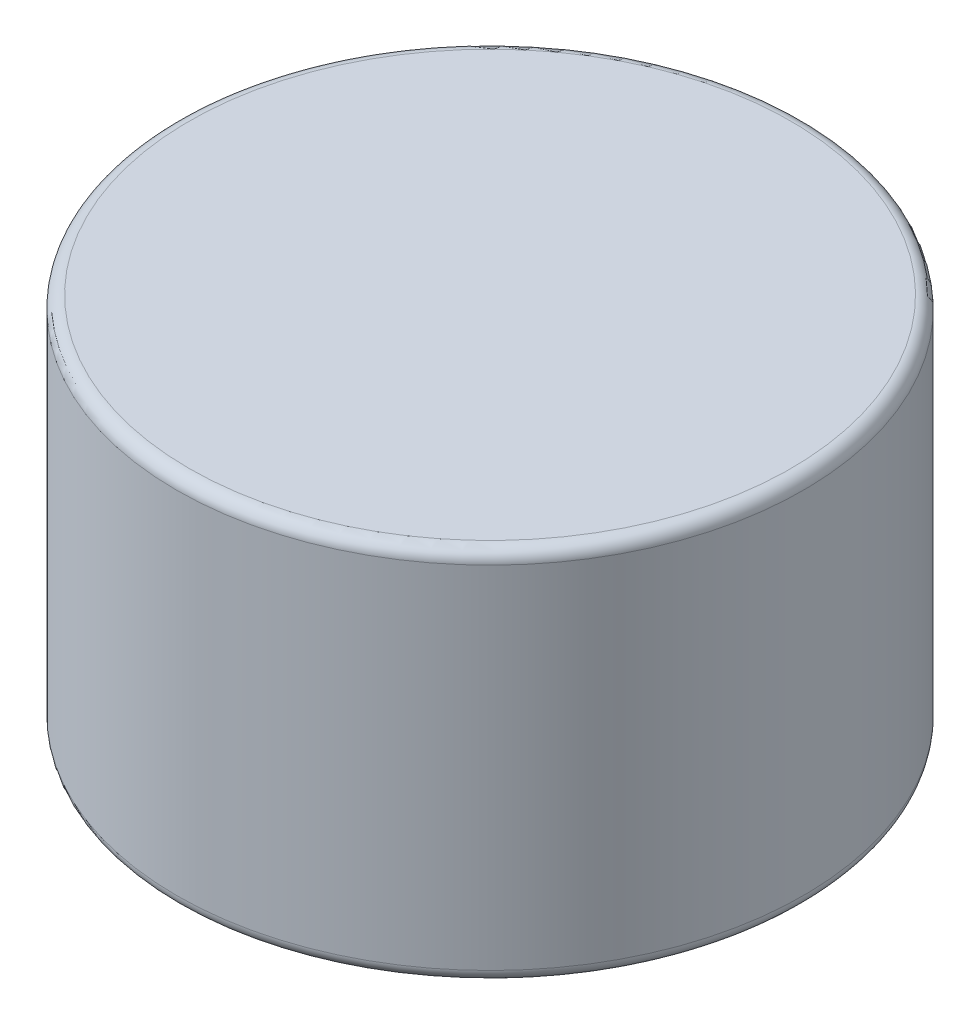
from build123d import *

# Parameters (mm, degrees)
SKETCH1_R           = 2.5
BOSS_EXTRUDE1_DEPTH = 3
FILLET1_R           = 0.1


with BuildPart() as part:
    # Sketch1 → Boss-Extrude1 (new body)
    with BuildSketch(Plane(origin=(0, 0, 0), x_dir=(1, 0, 0), z_dir=(0, 1, 0))):
        with Locations(Location((0, 0, 0), (0, 0, 270))):
            Circle(SKETCH1_R)
    extrude(amount=BOSS_EXTRUDE1_DEPTH)

    # Fillet1
    fillet1_edges = [part.edges().sort_by_distance(p)[0] for p in [
        (0, 0, -2.5),
        (0, 3, -2.5),
    ]]
    fillet(fillet1_edges, radius=FILLET1_R)


solid = part.part
